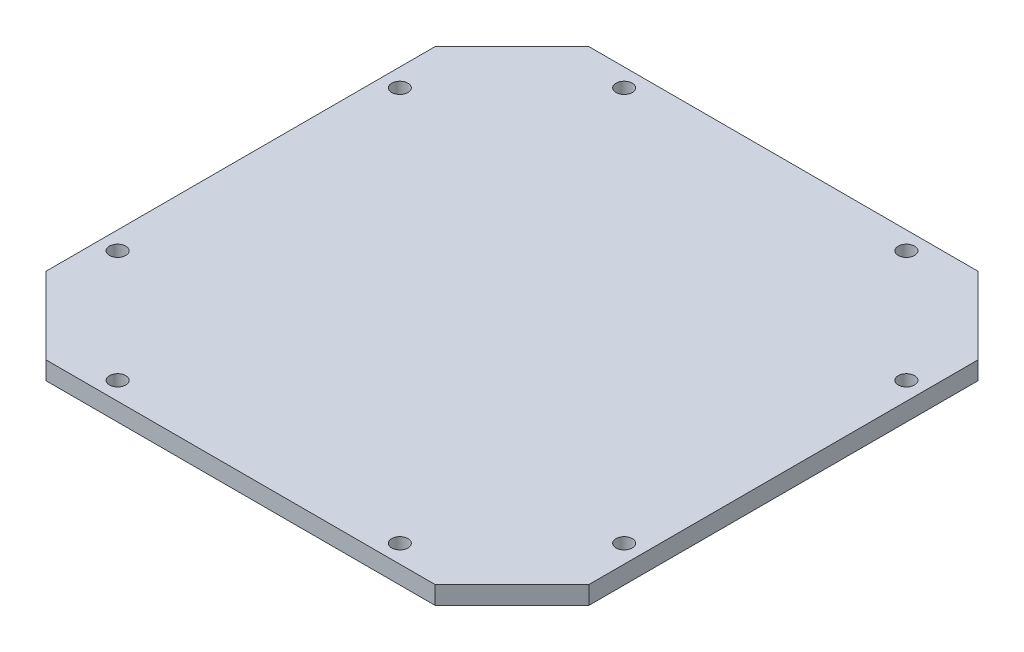
from build123d import *

# Parameters (mm, degrees)
SKETCH2_R           = 4.5
BOSS_EXTRUDE1_DEPTH = 5


with BuildPart() as part:
    # Sketch2 → Boss-Extrude1 (new, symmetric)
    with BuildSketch(Plane(origin=(0, 0, 0), x_dir=(1, 0, 0), z_dir=(0, 1, 0))):
        Polygon((107.573593129, 150), (-107.573593129, 150), (-150, 107.573593129), (-150, -107.573593129), (-107.573593129, -150), (107.573593129, -150), (150, -107.573593129), (150, 107.573593129), align=None)
        with Locations(Location((-78, 140, 0), (0, 0, 270))):
            Circle(SKETCH2_R, mode=Mode.SUBTRACT)
        with Locations(Location((78, 140, 0), (0, 0, 90))):
            Circle(SKETCH2_R, mode=Mode.SUBTRACT)
        with Locations(Location((-140, 78, 0), (0, 0, 270))):
            Circle(SKETCH2_R, mode=Mode.SUBTRACT)
        with Locations(Location((140, 78, 0), (0, 0, 90))):
            Circle(SKETCH2_R, mode=Mode.SUBTRACT)
        with Locations(Location((-140, -78, 0), (0, 0, 270))):
            Circle(SKETCH2_R, mode=Mode.SUBTRACT)
        with Locations(Location((140, -78, 0), (0, 0, 90))):
            Circle(SKETCH2_R, mode=Mode.SUBTRACT)
        with Locations(Location((-78, -140, 0), (0, 0, 270))):
            Circle(SKETCH2_R, mode=Mode.SUBTRACT)
        with Locations(Location((78, -140, 0), (0, 0, 90))):
            Circle(SKETCH2_R, mode=Mode.SUBTRACT)
    extrude(amount=BOSS_EXTRUDE1_DEPTH, both=True)


solid = part.part
